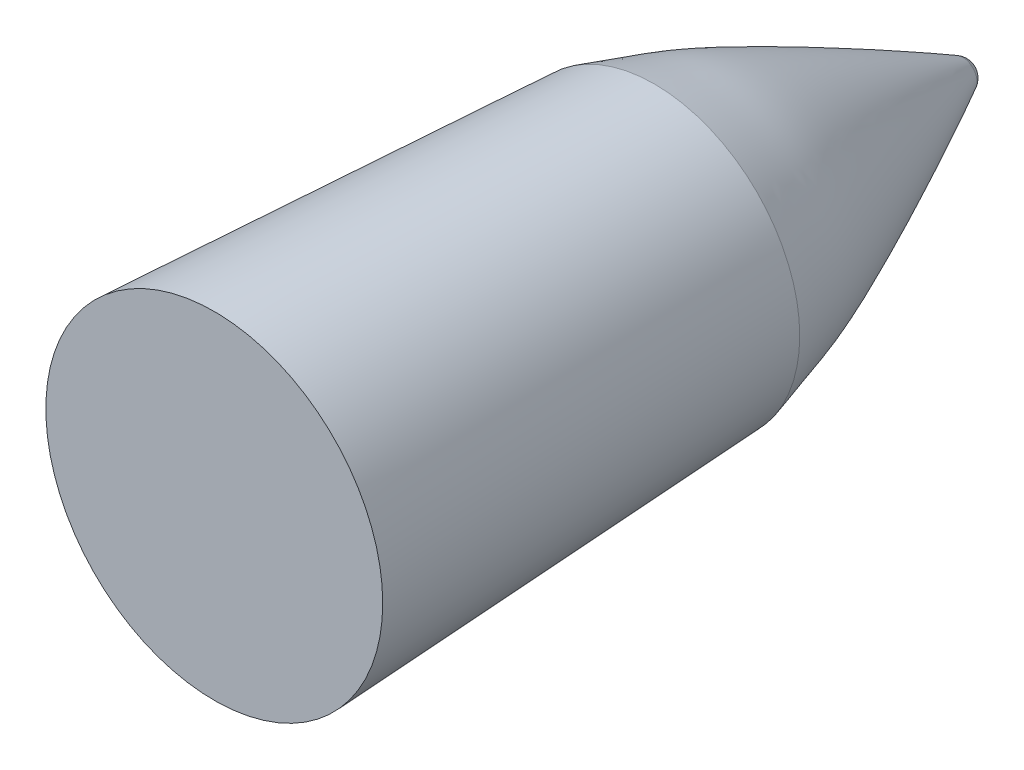
from build123d import *


with BuildPart() as part:
    # Эскиз1 → Повернуть1 (revolve)
    with BuildSketch(Plane(origin=(0, 0, 0), x_dir=(1, 0, 0), z_dir=(0, 1, 0))):
        with BuildLine():
            Line((-21, -20), (0, -20))
            Line((0, -20), (0, 76.509456591))
            add(Edge.make_bspline(
                [(-21, 23.303526799), (-20.950151988, 23.55619715), (-20.588242456, 25.356689417), (-19.861805291, 28.542980585), (-18.781007648, 32.618309393), (-17.683803917, 36.387694686), (-16.794111183, 39.324775715), (-16.139995318, 41.546015667), (-15.635538449, 43.197589032), (-15.024163935, 45.012380328), (-13.937228163, 47.886209516), (-11.955046686, 52.531179902), (-8.996626021, 58.945239937), (-6.340494309, 64.415530495), (-4.283171781, 68.509695264), (-2.81904039, 71.351111958), (-1.479938004, 73.873249362), (-0.567336195, 75.524317414), (-0.112134261, 76.316693352), (0, 76.509456591)],
                knots=[0.246223276, 0.246223276, 0.246223276, 0.246223276, 0.255865129, 0.31540599, 0.374946852, 0.434487714, 0.494028576, 0.523799007, 0.553569438, 0.583339868, 0.613110299, 0.672651161, 0.732192023, 0.791732885, 0.821503316, 0.851273747, 0.881044177, 0.910814608, 0.921120543, 0.921120543, 0.921120543, 0.921120543], degree=3))
            Line((-21, 23.303526799), (-21, -20))
        make_face()
    revolve(axis=Axis((0, 0, -76.509456591), (0, 0, 1)))

    # Эскиз2 → Вырез-Повернуть1 (revolve, cut)
    with BuildSketch(Plane(origin=(0, 0, 0), x_dir=(1, 0, 0), z_dir=(0, 1, 0))):
        Polygon((21, -20), (21, 66.971973821), (16.441991992, 66.971973821), align=None)
    revolve(axis=Axis((0, 0, 20), (0, 0, -1)), mode=Mode.SUBTRACT)

    # Эскиз3 → Вырез-Повернуть2 (revolve, cut)
    with BuildSketch(Plane(origin=(0, 0, 0), x_dir=(1, 0, 0), z_dir=(0, 1, 0))):
        with BuildLine():
            Line((1e-08, 76.509474859), (1e-08, 74.388246536))
            ThreePointArc((1e-08, 74.388246536), (1.026734817, 74.10458439), (1.762223825, 73.334062167))
            Line((1.762223825, 73.334062167), (4.025925166, 73.334062167))
            Line((4.025925166, 73.334062167), (4.025925166, 76.509474859))
            Line((4.025925166, 76.509474859), (1e-08, 76.509474859))
        make_face()
    revolve(axis=Axis((1e-08, 0, -76.509474859), (0, 0, 1)), mode=Mode.SUBTRACT)


solid = part.part
